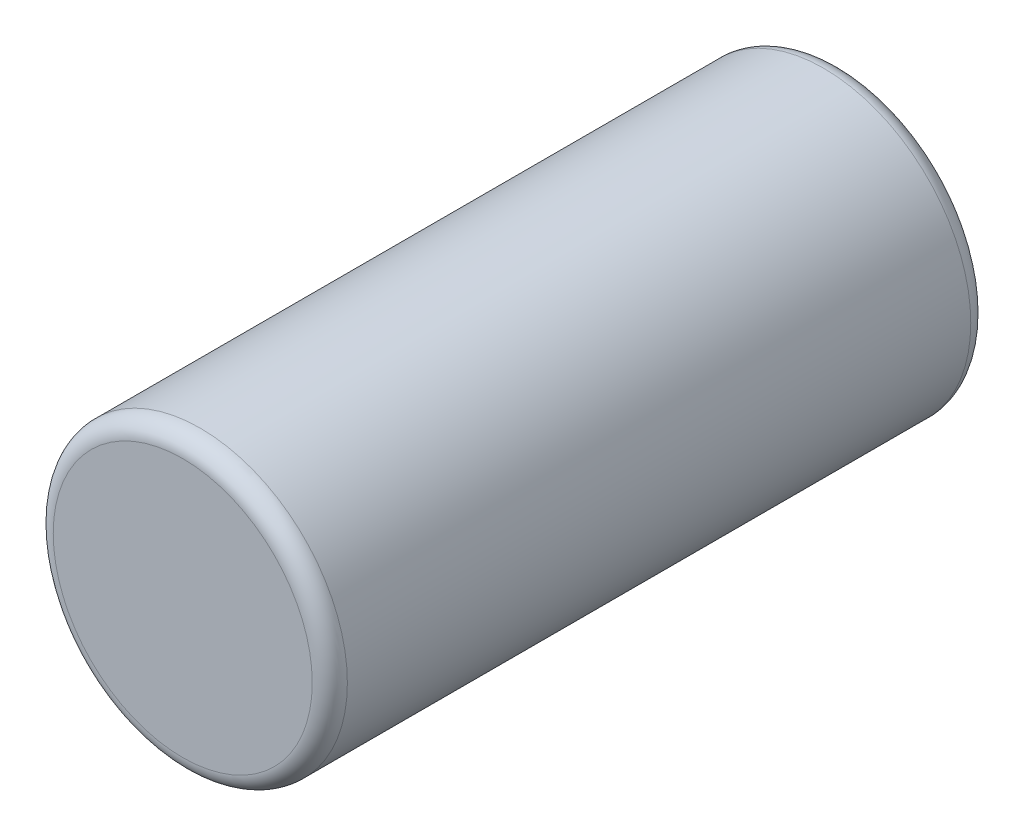
from build123d import *

# Parameters (mm, degrees)
SKETCH1_R           = 3.35
BOSS_EXTRUDE1_DEPTH = 15
FILLET1_R           = 0.4


with BuildPart() as part:
    # Sketch1 → Boss-Extrude1 (new body)
    with BuildSketch(Plane.XY):
        Circle(SKETCH1_R)
    extrude(amount=BOSS_EXTRUDE1_DEPTH)

    # Fillet1
    fillet1_edges = [part.edges().sort_by_distance(p)[0] for p in [
        (-3.35, 0, 0),
        (-3.35, 0, 15),
    ]]
    fillet(fillet1_edges, radius=FILLET1_R)


solid = part.part
